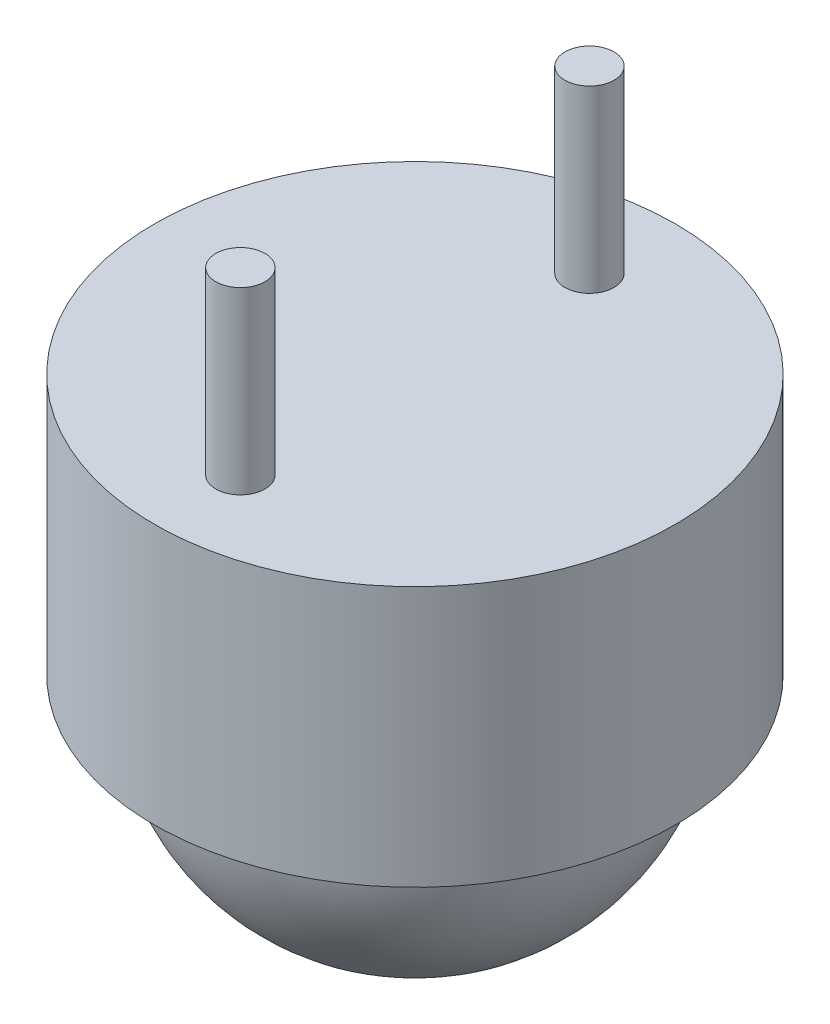
from build123d import *

# Parameters (mm, degrees)
SKETCH2_R          = 11.557
SKETCH2_R_2        = 9.525
HOUSING_PT_1_DEPTH = 9.525
SKETCH3_R          = 11.557
HOUSING_PT_2_DEPTH = 2.032
SKETCH4_R          = 1.09
SCREW_HOLES_DEPTH  = 2.032
SKETCH5_R          = 1.09
SCREWS_DEPTH       = 10
SCREWS_2_DEPTH     = 10


with BuildPart() as part:
    # Sketch1 → Metal Ball 3/4" (revolve)
    with BuildSketch(Plane.XY):
        with BuildLine():
            Line((0, -9.525), (0, 9.525))
            ThreePointArc((0, 9.525), (9.525, 0), (0, -9.525))
        make_face()
    revolve(axis=Axis((0, -9.525, 0), (0, 1, 0)))


with BuildPart() as body_2:
    # Sketch2 → Housing Pt. 1 (new body)
    with BuildSketch(Plane(origin=(0, 0, 0), x_dir=(1, 0, 0), z_dir=(0, 1, 0))):
        with Locations(Location((0, 0, 0), (0, 0, 90))):
            Circle(SKETCH2_R)
        with Locations(Location((0, 0, 0), (0, 0, 90))):
            Circle(SKETCH2_R_2, mode=Mode.SUBTRACT)
    extrude(amount=HOUSING_PT_1_DEPTH)

    # Sketch3 → Housing Pt. 2 (add)
    with BuildSketch(Plane(origin=(0, 9.525, 0), x_dir=(1, 0, 0), z_dir=(0, 1, 0))):
        with Locations(Location((0, 0, 0), (0, 0, 90))):
            Circle(SKETCH3_R)
    extrude(amount=HOUSING_PT_2_DEPTH)

    # Sketch4 → Screw Holes (cut)
    with BuildSketch(Plane(origin=(0, 11.557, 0), x_dir=(1, 0, 0), z_dir=(0, 1, 0))):
        with Locations(Location((0, 7.747, 0), (0, 0, 270))):
            Circle(SKETCH4_R)
        with Locations(Location((0, -7.747, 0), (0, 0, 270))):
            Circle(SKETCH4_R)
    extrude(amount=-SCREW_HOLES_DEPTH, mode=Mode.SUBTRACT)


with BuildPart() as body_3:
    # Sketch5 → Screws (new body)
    with BuildSketch(Plane.XZ.offset(-9.525)):
        with Locations(Location((0, 7.747, 0), (0, 0, 270))):
            Circle(SKETCH5_R)
    extrude(amount=-SCREWS_DEPTH)


with BuildPart() as body_4:
    # Sketch5 → Screws 2 (new body)
    with BuildSketch(Plane.XZ.offset(-9.525)):
        with Locations(Location((0, -7.747, 0), (0, 0, 270))):
            Circle(SKETCH5_R)
    extrude(amount=-SCREWS_2_DEPTH)


solid = Compound([part.part, body_2.part, body_3.part, body_4.part])
